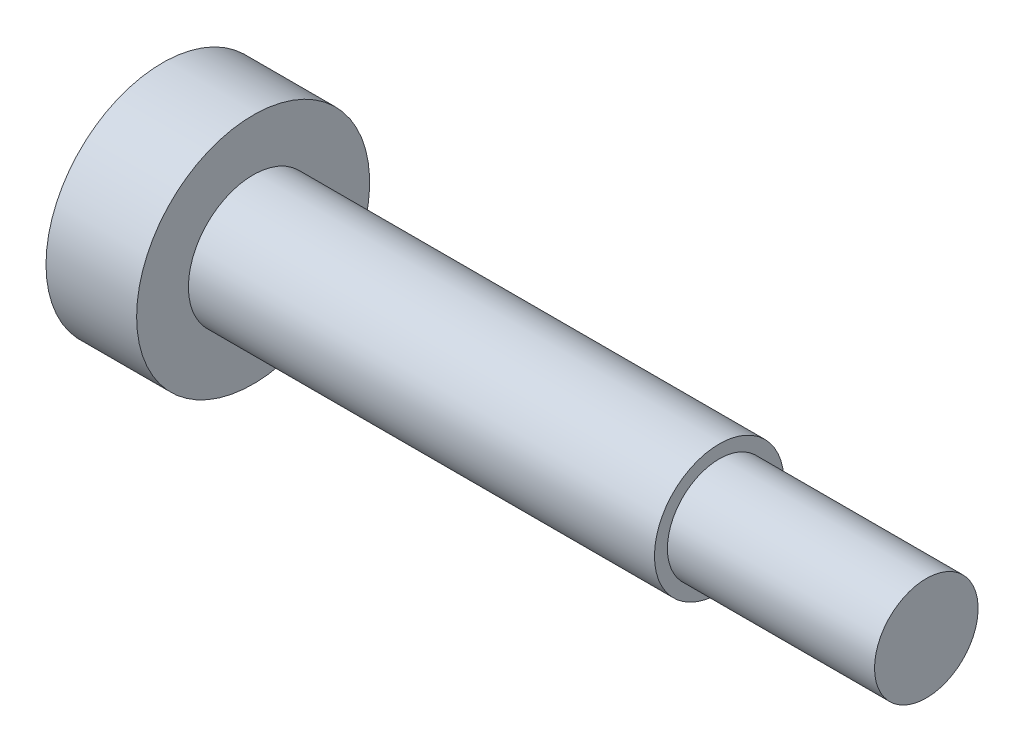
from build123d import *


with BuildPart() as part:
    # Sketch1 → Revolve1 (revolve)
    with BuildSketch(Plane(origin=(0, 0, 0), x_dir=(1, 0, 0), z_dir=(0, 1, 0)), mode=Mode.PRIVATE) as revolve1_sk:
        Polygon((0, 0), (0, 2), (-8, 2), (-8, 2.5), (-26, 2.5), (-26, 4.5), (-29.5, 4.5), (-29.5, 0), align=None)
    revolve(revolve1_sk.sketch.rotate(Axis((-29.5, 0, 0), (1, 0, 0)), 180), axis=Axis((-29.5, 0, 0), (1, 0, 0)))


solid = part.part
